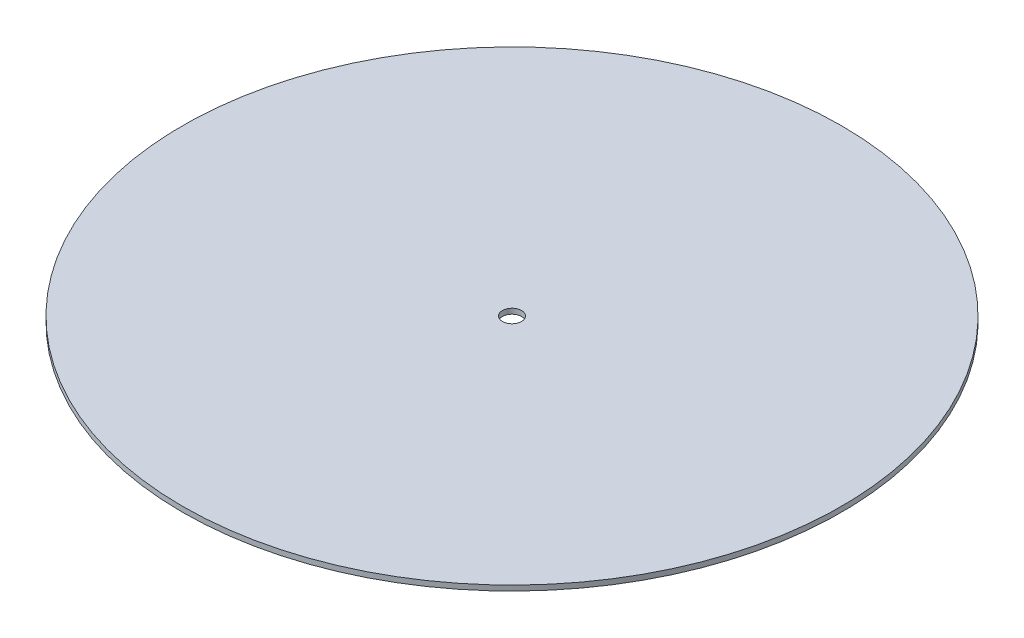
from build123d import *

# Parameters (mm, degrees)
SKETCH_1_R              = 190
EXTRUDE_1_DEPTH         = 3
HOLE_WIZARD_11_0_11_1_D = 11


with BuildPart() as part:
    # 草图1 → 凸台-拉伸1 (new body)
    with BuildSketch(Plane(origin=(0, 0, 0), x_dir=(1, 0, 0), z_dir=(0, 1, 0))):
        with Locations(Location((0, 0, 0), (0, 0, 270))):
            Circle(SKETCH_1_R)
    extrude(amount=EXTRUDE_1_DEPTH)

    # Ø11.0 (11) 直径孔1 (through all)
    with Locations(Plane(origin=(0, 3, 0), x_dir=(1, 0, 0), z_dir=(0, 1, 0))):
        with Locations((0, 0)):
            Hole(HOLE_WIZARD_11_0_11_1_D / 2)


solid = part.part
